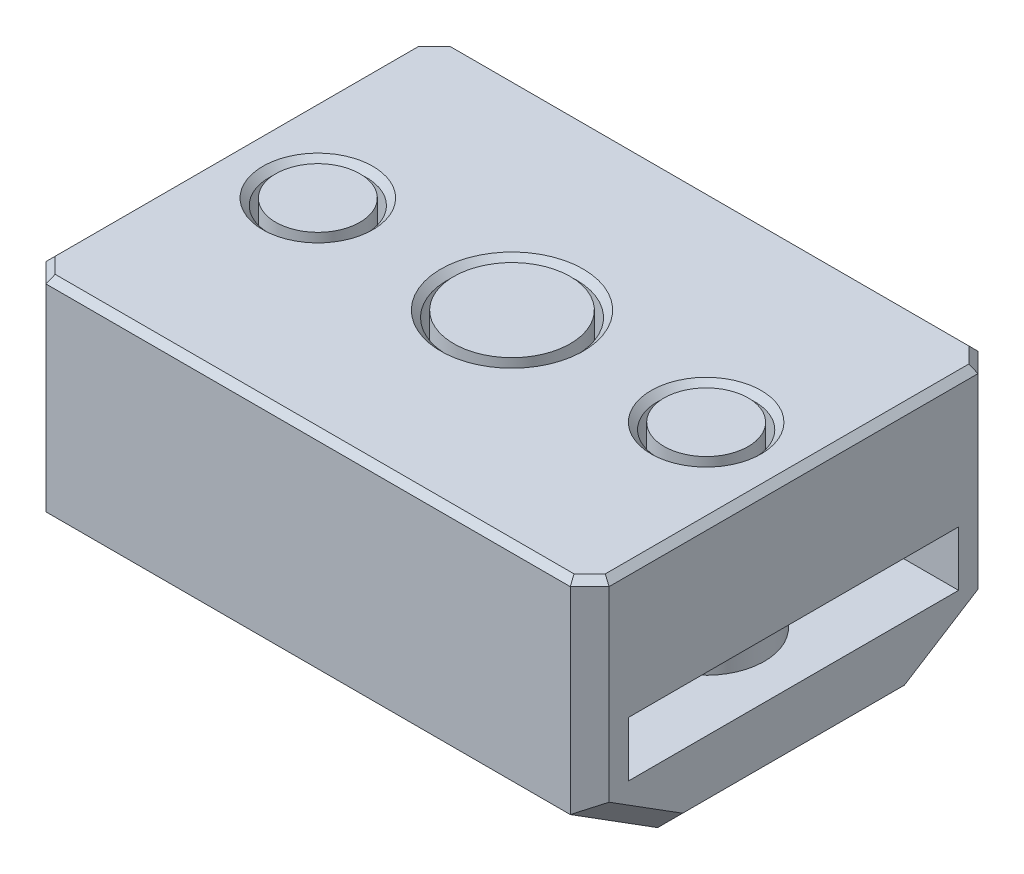
from build123d import *

# Parameters (mm, degrees)
SKETCH3_W               = 17.4000014
SKETCH3_H               = 12.59999981
SKETCH3_R               = 1.5
SKETCH3_R_2             = 2
BOSS_EXTRUDE1_DEPTH     = 4
BOSS_EXTRUDE2_START     = -4
SKETCH4_R               = 1.5
SKETCH4_R_2             = 1
BOSS_EXTRUDE2_DEPTH     = 0.8
BOSS_EXTRUDE7_START     = 0.2
SKETCH11_R              = 1.3
BOSS_EXTRUDE7_DEPTH     = 3
BOSS_EXTRUDE7_2_DEPTH   = 3
SKETCH5_W               = 17.4000014
SKETCH5_H               = 1.2
BOSS_EXTRUDE3_DEPTH     = 1.7
BOSS_EXTRUDE5_START     = 0.6
SKETCH8_W               = 17.4000014
SKETCH8_H               = 12.59999981
SKETCH8_R               = 1.00000054
BOSS_EXTRUDE5_DEPTH     = 0.6
BOSS_EXTRUDE8_START     = 1.7
SKETCH12_W              = 17.4000014
SKETCH12_H              = 12.59999981
SKETCH12_R              = 1.00000054
BOSS_EXTRUDE8_DEPTH     = 1.7
CUT_EXTRUDE1_DEPTH      = 19.932777068
CUT_EXTRUDE1_DEPTH_BACK = 19.932777068
CHAMFER1_SIZE           = 0.6
CHAMFER3_SIZE           = 0.2
BOSS_EXTRUDE9_START     = 0.2
SKETCH14_R              = 1.8
BOSS_EXTRUDE9_DEPTH     = 5.5
BOSS_EXTRUDE10_START    = 0.2
SKETCH15_R              = 1.80000054
SKETCH15_R_2            = 1.00000054
BOSS_EXTRUDE10_DEPTH    = 1.3
BOSS_EXTRUDE10_2_DEPTH  = 1.3


with BuildPart() as part:
    # Sketch3 → Boss-Extrude1 (new body)
    with BuildSketch(Plane(origin=(0, 0, 0), x_dir=(1, 0, 0), z_dir=(0, 1, 0))):
        Rectangle(SKETCH3_W, SKETCH3_H)
        with Locations(Location((-6.0000007, 0, 0), (0, 0, 270))):
            Circle(SKETCH3_R, mode=Mode.SUBTRACT)
        with Locations(Location((0, 0, 0), (0, 0, 270))):
            Circle(SKETCH3_R_2, mode=Mode.SUBTRACT)
        with Locations(Location((6.0000007, 0, 0), (0, 0, 270))):
            Circle(SKETCH3_R, mode=Mode.SUBTRACT)
    extrude(amount=BOSS_EXTRUDE1_DEPTH)

    # Sketch4 → Boss-Extrude2 (add)
    # profile 1 of 2: a face of its own
    with BuildSketch(Plane(origin=(0, 4, 0), x_dir=(1, 0, 0), z_dir=(0, 1, 0)).offset(BOSS_EXTRUDE2_START)):
        with Locations(Location((6.0000007, 0, 0), (0, 0, 270))):
            Circle(SKETCH4_R)
        with Locations(Location((6.0000007, 0, 0), (0, 0, 270))):
            Circle(SKETCH4_R_2, mode=Mode.SUBTRACT)
    # profile 2 of 2: a face of its own
    with BuildSketch(Plane(origin=(0, 4, 0), x_dir=(1, 0, 0), z_dir=(0, 1, 0)).offset(BOSS_EXTRUDE2_START)):
        with Locations(Location((-6.0000007, 0, 0), (0, 0, 270))):
            Circle(SKETCH4_R)
        with Locations(Location((-6.0000007, 0, 0), (0, 0, 270))):
            Circle(SKETCH4_R_2, mode=Mode.SUBTRACT)
    extrude(amount=BOSS_EXTRUDE2_DEPTH)

    # Sketch5 → Boss-Extrude3 (add)
    with BuildSketch(Plane.XZ):
        with Locations((0, 5.699999905)):
            Rectangle(SKETCH5_W, SKETCH5_H)
        with Locations((0, -5.699999905)):
            Rectangle(SKETCH5_W, SKETCH5_H)
    extrude(amount=BOSS_EXTRUDE3_DEPTH)

    # Sketch8 → Boss-Extrude5 (add)
    with BuildSketch(Plane.XZ.offset(1.7).offset(BOSS_EXTRUDE5_START)):
        Rectangle(SKETCH8_W, SKETCH8_H)
        with Locations(Location((6.0000007, 0, 0), (0, 0, 90))):
            Circle(SKETCH8_R, mode=Mode.SUBTRACT)
        with Locations(Location((-6.0000007, 0, 0), (0, 0, 90))):
            Circle(SKETCH8_R, mode=Mode.SUBTRACT)
        with Locations(Location((0, 0, 0), (0, 0, 270))):
            Circle(SKETCH8_R, mode=Mode.SUBTRACT)
    extrude(amount=-BOSS_EXTRUDE5_DEPTH)

    # Sketch12 → Boss-Extrude8 (add)
    with BuildSketch(Plane.XZ.offset(2.3).offset(BOSS_EXTRUDE8_START)):
        Rectangle(SKETCH12_W, SKETCH12_H)
        with Locations(Location((6.0000007, 0, 0), (0, 0, 90))):
            Circle(SKETCH12_R, mode=Mode.SUBTRACT)
        with Locations(Location((-6.0000007, 0, 0), (0, 0, 90))):
            Circle(SKETCH12_R, mode=Mode.SUBTRACT)
        Polygon((-1.154700538, 2), (-2.309401077, 0), (-1.154700538, -2), (1.154700538, -2), (2.309401077, 0), (1.154700538, 2), align=None, mode=Mode.SUBTRACT)
    extrude(amount=-BOSS_EXTRUDE8_DEPTH)

    # Sketch13 → Cut-Extrude1 (cut, two sides: drawn at the far end of the back side and taken through both)
    with BuildSketch(Plane.ZY.offset(8.7000007).offset(-CUT_EXTRUDE1_DEPTH_BACK)):
        Polygon((6.299999905, -4), (3.6, -4), (6.299999905, -2.3), align=None)
        Polygon((-6.299999905, -4), (-6.299999905, -2.3), (-3.6, -4), align=None)
    extrude(amount=CUT_EXTRUDE1_DEPTH + CUT_EXTRUDE1_DEPTH_BACK, mode=Mode.SUBTRACT)

    # Chamfer1
    chamfer1_edges = [part.edges().sort_by_distance(p)[0] for p in [
        (-8.7000007, -4, 0),
        (8.7000007, -4, 0),
        (-8.7000007, -3.15, 4.949999952),
        (8.7000007, -3.15, 4.949999952),
        (-8.7000007, -3.15, -4.949999952),
        (8.7000007, -3.15, -4.949999952),
        (8.7000007, 0.85, -6.299999905),
        (8.7000007, 0.85, 6.299999905),
        (-8.7000007, 0.85, 6.299999905),
        (-8.7000007, 0.85, -6.299999905),
    ]]
    chamfer(chamfer1_edges, length=CHAMFER1_SIZE)

    # Chamfer3
    chamfer3_edges = [part.edges().sort_by_distance(p)[0] for p in [
        (-6.0000007, 4, -1.5),
        (8.7000007, 4, 0),
        (0, 4, 6.299999905),
        (0, 4, -6.299999905),
        (-8.7000007, 4, 0),
        (-8.4000007, 4, -5.999999905),
        (-8.4000007, 4, 5.999999905),
        (8.4000007, 4, -5.999999905),
        (8.4000007, 4, 5.999999905),
        (0, 4, -2),
        (6.0000007, 4, -1.5),
    ]]
    chamfer(chamfer3_edges, length=CHAMFER3_SIZE)


with BuildPart() as body_2:
    # Sketch11 → Boss-Extrude7 (new body)
    with BuildSketch(Plane(origin=(0, 0.8, 0), x_dir=(1, 0, 0), z_dir=(0, 1, 0)).offset(BOSS_EXTRUDE7_START)):
        with Locations(Location((-6.0000007, 0, 0), (0, 0, 90))):
            Circle(SKETCH11_R)
    extrude(amount=BOSS_EXTRUDE7_DEPTH)


with BuildPart() as body_3:
    # Sketch11 → Boss-Extrude7 2 (new body)
    with BuildSketch(Plane(origin=(0, 0.8, 0), x_dir=(1, 0, 0), z_dir=(0, 1, 0)).offset(BOSS_EXTRUDE7_START)):
        with Locations(Location((6.0000007, 0, 0), (0, 0, 90))):
            Circle(SKETCH11_R)
    extrude(amount=BOSS_EXTRUDE7_2_DEPTH)


with BuildPart() as body_4:
    # Sketch14 → Boss-Extrude9 (new body)
    with BuildSketch(Plane(origin=(0, -1.7, 0), x_dir=(1, 0, 0), z_dir=(0, 1, 0)).offset(BOSS_EXTRUDE9_START)):
        with Locations(Location((0, 0, 0), (0, 0, 90))):
            Circle(SKETCH14_R)
    extrude(amount=BOSS_EXTRUDE9_DEPTH)


with BuildPart() as body_5:
    # Sketch15 → Boss-Extrude10 (new body)
    with BuildSketch(Plane(origin=(0, -1.7, 0), x_dir=(1, 0, 0), z_dir=(0, 1, 0)).offset(BOSS_EXTRUDE10_START)):
        with Locations(Location((-6.0000007, 0, 0), (0, 0, 90))):
            Circle(SKETCH15_R)
        with Locations(Location((-6.0000007, 0, 0), (0, 0, 90))):
            Circle(SKETCH15_R_2, mode=Mode.SUBTRACT)
    extrude(amount=BOSS_EXTRUDE10_DEPTH)


with BuildPart() as body_6:
    # Sketch15 → Boss-Extrude10 2 (new body)
    with BuildSketch(Plane(origin=(0, -1.7, 0), x_dir=(1, 0, 0), z_dir=(0, 1, 0)).offset(BOSS_EXTRUDE10_START)):
        with Locations(Location((6.0000007, 0, 0), (0, 0, 90))):
            Circle(SKETCH15_R)
        with Locations(Location((6.0000007, 0, 0), (0, 0, 90))):
            Circle(SKETCH15_R_2, mode=Mode.SUBTRACT)
    extrude(amount=BOSS_EXTRUDE10_2_DEPTH)


solid = Compound([part.part, body_2.part, body_3.part, body_4.part, body_5.part, body_6.part])
